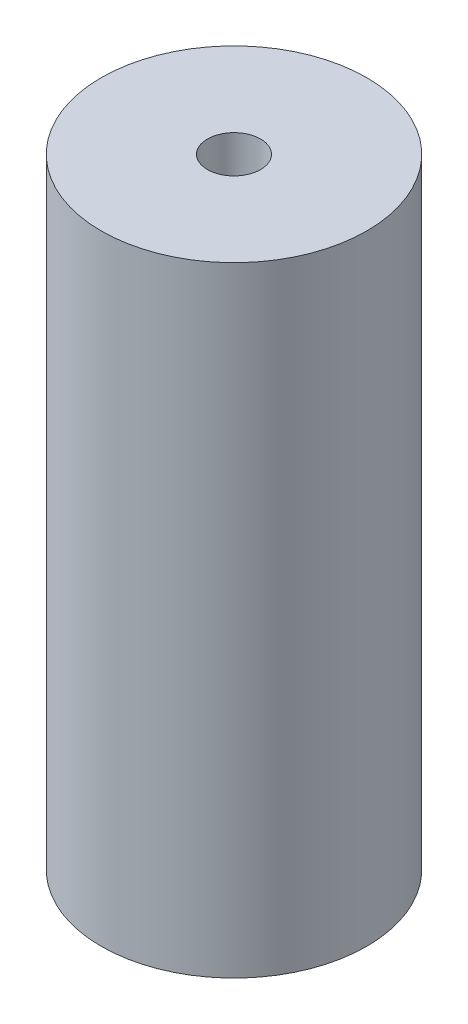
from build123d import *

# Parameters (mm, degrees)
CUT_EXTRUDE2_DEPTH = 30
SKETCH6_W          = 2.5
SKETCH6_H          = 5
CUT_REVOLVE1_ANGLE = 50


with BuildPart() as part:
    # Sketch1 → Revolve1 (revolve)
    with BuildSketch(Plane.XY):
        Polygon((3, 30), (15, 30), (15, -40), (0, -40), (0, 0), (3, 0), align=None)
    revolve(axis=Axis((0, -40, 0), (0, 1, 0)))

    # Sketch3 → Cut-Extrude2 (cut)
    with BuildSketch(Plane.XZ.offset(40)):
        with BuildLine():
            Line((-2.5, 12.182458366), (-2.5, 9.682458366))
            ThreePointArc((-2.5, 9.682458366), (0, -10), (2.5, 9.682458366))
            Line((2.5, 9.682458366), (2.5, 12.182458366))
            Line((2.5, 12.182458366), (-2.5, 12.182458366))
        make_face()
    extrude(amount=-CUT_EXTRUDE2_DEPTH, mode=Mode.SUBTRACT)

    # Sketch6 → Cut-Revolve1 (revolve, cut)
    with BuildSketch(Plane(origin=(0, 0, 0), x_dir=(0, 0, -1), z_dir=(1, 0, 0))):
        with Locations((-11.25, -12.5)):
            Rectangle(SKETCH6_W, SKETCH6_H)
    revolve(axis=Axis((0, 0, 0), (0, -1, 0)), revolution_arc=CUT_REVOLVE1_ANGLE, mode=Mode.SUBTRACT)


solid = part.part
